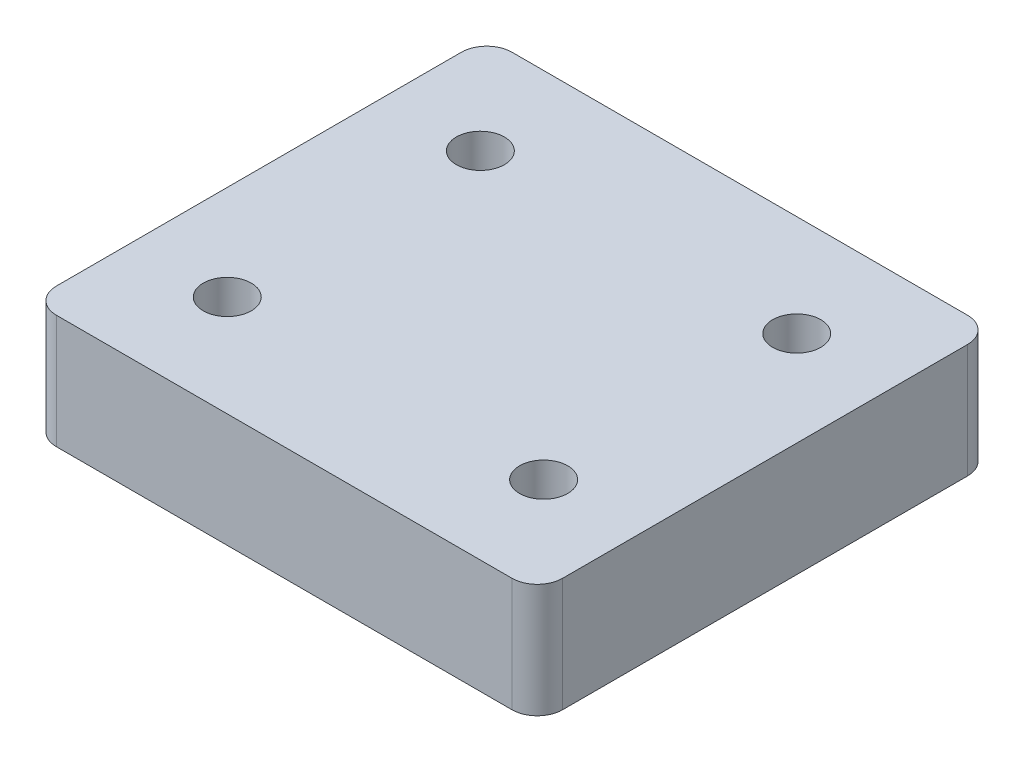
from build123d import *

# Parameters (mm, degrees)
SKETCH1_W           = 40
SKETCH1_H           = 36
BOSS_EXTRUDE1_DEPTH = 9
SKETCH2_R           = 1.9
CUT_EXTRUDE1_DEPTH  = 10
FILLET1_R           = 2


with BuildPart() as part:
    # Sketch1 → Boss-Extrude1 (new body)
    with BuildSketch(Plane(origin=(0, 0, 0), x_dir=(1, 0, 0), z_dir=(0, 1, 0))):
        with Locations((9.482291419, -1.319229855)):
            Rectangle(SKETCH1_W, SKETCH1_H)
    extrude(amount=BOSS_EXTRUDE1_DEPTH)

    # Sketch2 → Cut-Extrude1 (cut)
    with BuildSketch(Plane(origin=(0, 9, 0), x_dir=(1, 0, 0), z_dir=(0, 1, 0))):
        with Locations(Location((-3.017708581, -11.319229855, 0), (0, 0, 270))):
            Circle(SKETCH2_R)
        with Locations(Location((21.982291419, -11.319229855, 0), (0, 0, 270))):
            Circle(SKETCH2_R)
        with Locations(Location((-3.017708581, 8.680770145, 0), (0, 0, 270))):
            Circle(SKETCH2_R)
        with Locations(Location((21.982291419, 8.680770145, 0), (0, 0, 270))):
            Circle(SKETCH2_R)
    extrude(amount=-CUT_EXTRUDE1_DEPTH, mode=Mode.SUBTRACT)

    # Fillet1
    fillet1_edges = [part.edges().sort_by_distance(p)[0] for p in [
        (-10.517708581, 4.5, -16.680770145),
        (29.482291419, 4.5, -16.680770145),
        (29.482291419, 4.5, 19.319229855),
        (-10.517708581, 4.5, 19.319229855),
    ]]
    fillet(fillet1_edges, radius=FILLET1_R)


solid = part.part
